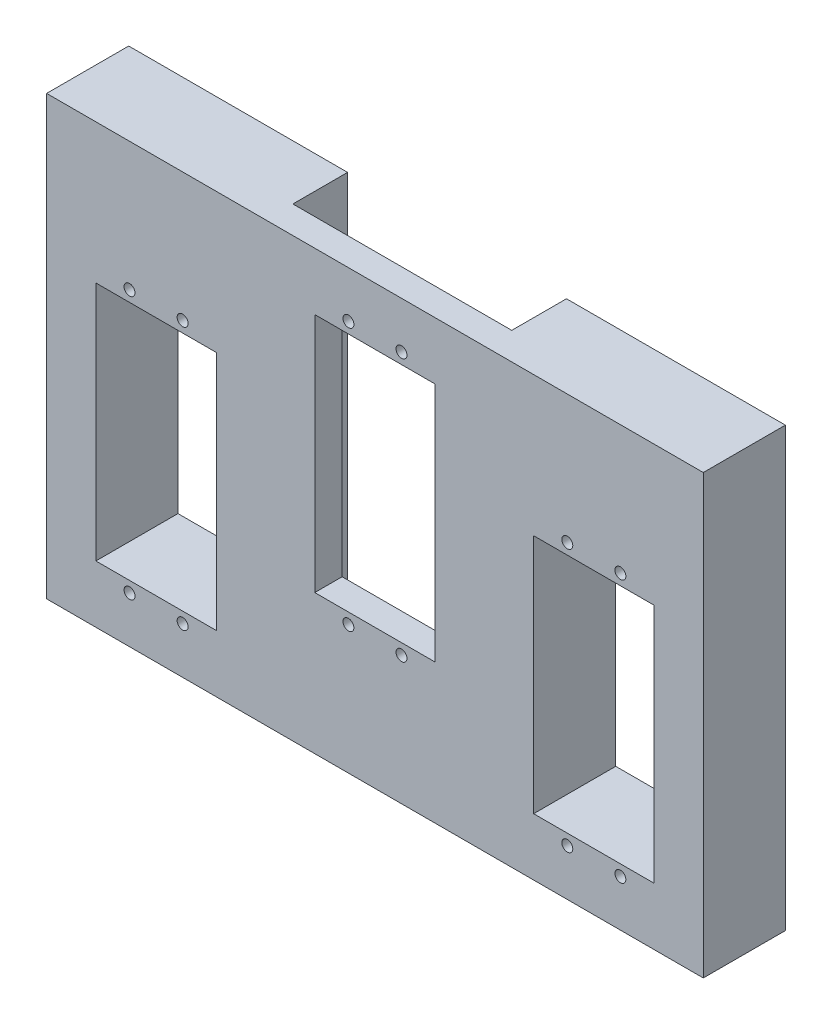
from build123d import *

# Parameters (mm, degrees)
SKETCH1_W           = 120
SKETCH1_H           = 80
BOSS_EXTRUDE1_DEPTH = 7.5
SKETCH2_R           = 1
SKETCH2_W           = 22
SKETCH2_H           = 44
CUT_EXTRUDE1_DEPTH  = 15
CUT_EXTRUDE2_REACH  = 102.281
SKETCH3_W           = 40
SKETCH3_H           = 10


with BuildPart() as part:
    # Sketch1 → Boss-Extrude1 (new, symmetric)
    with BuildSketch(Plane.XY):
        Rectangle(SKETCH1_W, SKETCH1_H)
    extrude(amount=BOSS_EXTRUDE1_DEPTH, both=True)

    # Sketch2 → Cut-Extrude1 (cut)
    with BuildSketch(Plane.XY.offset(7.5)):
        with Locations((-44.85, -31.5)):
            Circle(SKETCH2_R)
        with Locations((-35.15, -31.5)):
            Circle(SKETCH2_R)
        with Locations((-35.15, 16.5)):
            Circle(SKETCH2_R)
        with Locations((-44.85, 16.5)):
            Circle(SKETCH2_R)
        with Locations((35.15, -31.5)):
            Circle(SKETCH2_R)
        with Locations((44.85, -31.5)):
            Circle(SKETCH2_R)
        with Locations((44.85, 16.5)):
            Circle(SKETCH2_R)
        with Locations((35.15, 16.5)):
            Circle(SKETCH2_R)
        with Locations((-4.85, -16.5)):
            Circle(SKETCH2_R)
        with Locations((4.85, -16.5)):
            Circle(SKETCH2_R)
        with Locations((4.85, 31.5)):
            Circle(SKETCH2_R)
        with Locations((-4.85, 31.5)):
            Circle(SKETCH2_R)
        with Locations((-40, -7.5)):
            Rectangle(SKETCH2_W, SKETCH2_H)
        with Locations((40, -7.5)):
            Rectangle(SKETCH2_W, SKETCH2_H)
        with Locations((0, 7.5)):
            Rectangle(SKETCH2_W, SKETCH2_H)
    extrude(amount=-CUT_EXTRUDE1_DEPTH, mode=Mode.SUBTRACT)

    # Cut-Extrude2: up to this face of the body (flat: up to its plane)
    cut_extrude2_end = Plane(part.part.faces().sort_by_distance((0, -40, 0))[0])
    # Sketch3 → Cut-Extrude2 (cut, up to the picked face)
    with BuildSketch(Plane(origin=(0, 40, 0), x_dir=(1, 0, 0), z_dir=(0, 1, 0)), mode=Mode.PRIVATE) as cut_extrude2_sk1:
        with Locations((0, 2.5)):
            Rectangle(SKETCH3_W, SKETCH3_H)
    cut_extrude2_tool1 = split(extrude(cut_extrude2_sk1.sketch, amount=-CUT_EXTRUDE2_REACH, mode=Mode.PRIVATE), bisect_by=cut_extrude2_end, keep=Keep.BOTH, mode=Mode.PRIVATE)
    add(cut_extrude2_tool1.solids().sort_by(Axis((0, 40, -2.5), (0, -1, 0)))[0], mode=Mode.SUBTRACT)


solid = part.part
